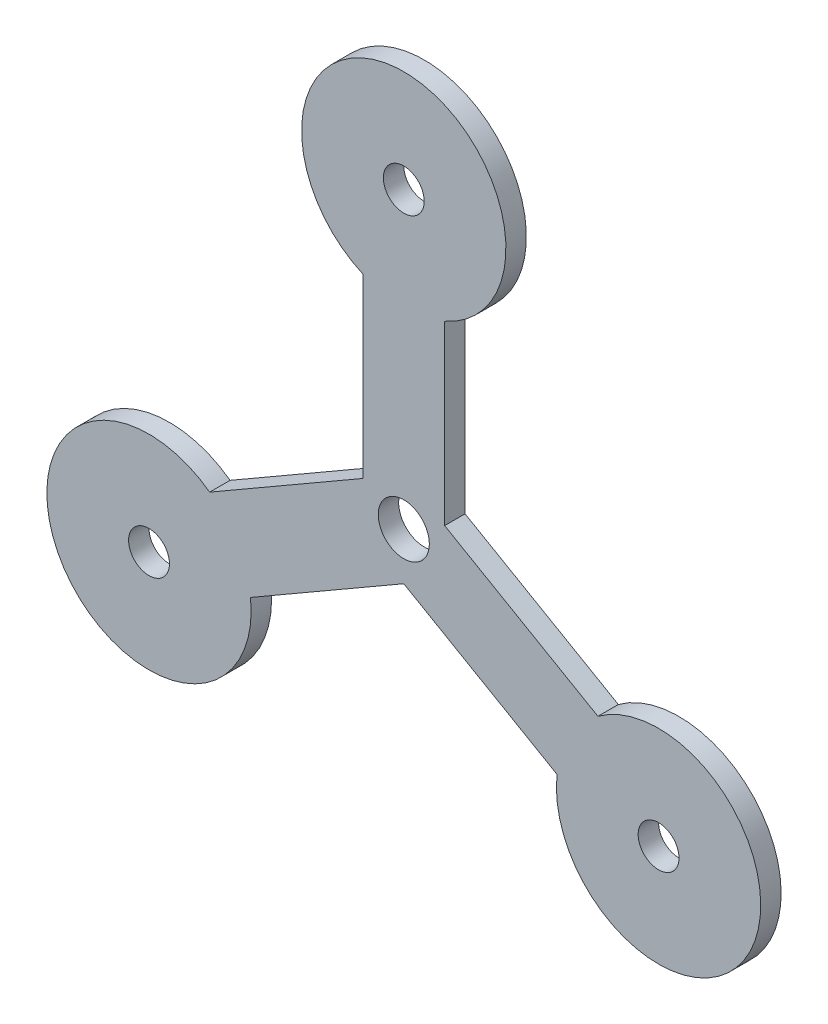
from build123d import *

# Parameters (mm, degrees)
BOSS_EXTRUDE2_DEPTH = 10
SKETCH3_R           = 50
BOSS_EXTRUDE3_DEPTH = 10
SKETCH4_R           = 10
BOSS_EXTRUDE4_DEPTH = 90
CUT_EXTRUDE1_START  = -30
SKETCH5_R           = 10
CUT_EXTRUDE1_DEPTH  = 30
SKETCH6_R           = 13
CUT_EXTRUDE2_DEPTH  = 10
SKETCH7_R           = 10
BOSS_EXTRUDE5_DEPTH = 30
SKETCH8_R           = 20.369169003
BOSS_EXTRUDE6_DEPTH = 10
CUT_EXTRUDE3_START  = -100
SKETCH9_R           = 10
CUT_EXTRUDE3_DEPTH  = 100
SKETCH10_R          = 10
CUT_EXTRUDE4_DEPTH  = 10
SKETCH11_R          = 12.5
CUT_EXTRUDE5_DEPTH  = 10
SCALE1_SCALE        = 0.2


with BuildPart() as part:
    # Sketch1 → Boss-Extrude2 (new body)
    with BuildSketch(Plane.XY):
        Polygon((20, 144), (-20, 144), (-20, 11.547005384), (-134.707658145, -54.679491924), (-114.707658145, -89.320508076), (0, -23.094010768), (114.707658145, -89.320508076), (134.707658145, -54.679491924), (20, 11.547005384), align=None)
    extrude(amount=BOSS_EXTRUDE2_DEPTH)

    # Sketch3 → Boss-Extrude3 (add)
    with BuildSketch(Plane.XY.offset(10)):
        with Locations((-124.707658145, -72)):
            Circle(SKETCH3_R)
        with Locations((0, 144)):
            Circle(SKETCH3_R)
        with Locations((124.707658145, -72)):
            Circle(SKETCH3_R)
    extrude(amount=-BOSS_EXTRUDE3_DEPTH)

    # Sketch4 → Boss-Extrude4 (add)
    with BuildSketch(Plane.XY.offset(10)):
        with Locations(Location((0, 144, 0), (0, 0, 180))):
            Circle(SKETCH4_R)
        with Locations(Location((124.707658145, -72, 0), (0, 0, 180))):
            Circle(SKETCH4_R)
        with Locations(Location((-124.707658145, -72, 0), (0, 0, 180))):
            Circle(SKETCH4_R)
    extrude(amount=BOSS_EXTRUDE4_DEPTH)

    # Sketch5 → Cut-Extrude1 (cut)
    with BuildSketch(Plane.XY.offset(100).offset(CUT_EXTRUDE1_START)):
        with Locations(Location((0, 144, 0), (0, 0, 180))):
            Circle(SKETCH5_R)
    extrude(amount=CUT_EXTRUDE1_DEPTH, mode=Mode.SUBTRACT)

    # Sketch6 → Cut-Extrude2 (cut)
    with BuildSketch(Plane.XY.offset(10)):
        Circle(SKETCH6_R)
    extrude(amount=-CUT_EXTRUDE2_DEPTH, mode=Mode.SUBTRACT)

    # Sketch7 → Boss-Extrude5 (add)
    with BuildSketch(Plane.XY.offset(70)):
        with Locations(Location((0, 144, 0), (0, 0, 180))):
            Circle(SKETCH7_R)
    extrude(amount=BOSS_EXTRUDE5_DEPTH)

    # Sketch8 → Boss-Extrude6 (add)
    with BuildSketch(Plane.XY.offset(10)):
        Circle(SKETCH8_R)
    extrude(amount=-BOSS_EXTRUDE6_DEPTH)

    # Sketch9 → Cut-Extrude3 (cut)
    with BuildSketch(Plane.XY.offset(100).offset(CUT_EXTRUDE3_START)):
        with Locations((-124.707658145, -72)):
            Circle(SKETCH9_R)
        with Locations((0, 144)):
            Circle(SKETCH9_R)
        with Locations((124.707658145, -72)):
            Circle(SKETCH9_R)
    extrude(amount=CUT_EXTRUDE3_DEPTH, mode=Mode.SUBTRACT)

    # Sketch10 → Cut-Extrude4 (cut)
    with BuildSketch(Plane.XY.offset(10)):
        Circle(SKETCH10_R)
    extrude(amount=-CUT_EXTRUDE4_DEPTH, mode=Mode.SUBTRACT)

    # Sketch11 → Cut-Extrude5 (cut)
    with BuildSketch(Plane.XY.offset(10)):
        Circle(SKETCH11_R)
    extrude(amount=-CUT_EXTRUDE5_DEPTH, mode=Mode.SUBTRACT)


with BuildPart() as part_1:
    # Scale1: scaled about (0, 0, 5)
    add(part.part.scale(SCALE1_SCALE).moved(Location((0, 0, 4))))


solid = part_1.part
